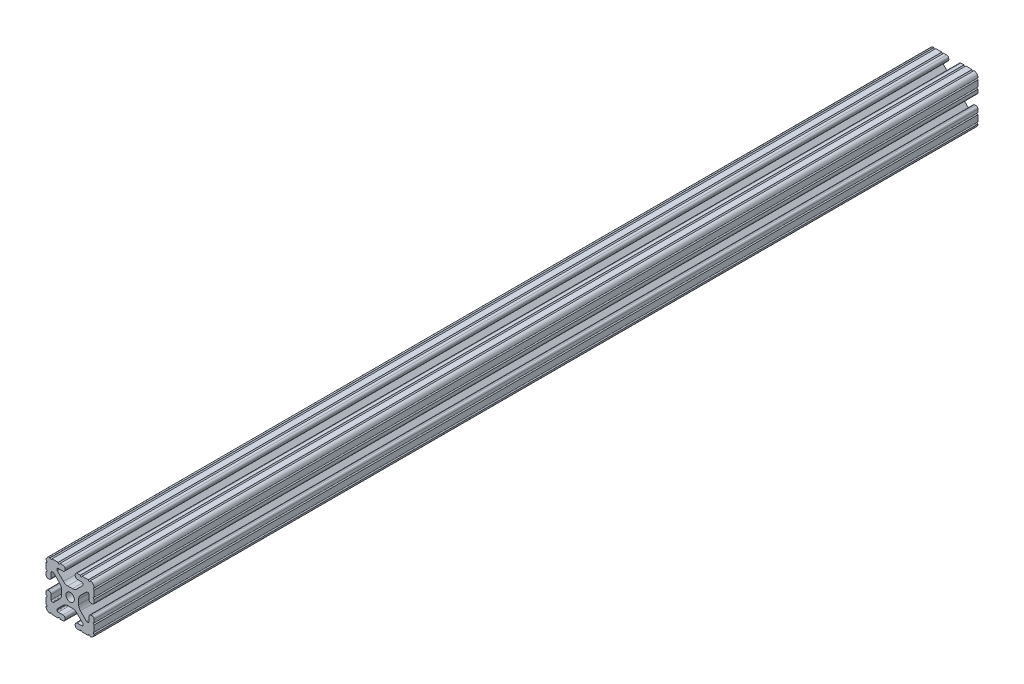
from build123d import *

# Parameters (mm, degrees)
SKETCH1_R           = 3.3274
BOSS_EXTRUDE1_DEPTH = 698.5


with BuildPart() as part:
    # Sketch1 → Boss-Extrude1 (new body)
    with BuildSketch(Plane.XY):
        with BuildLine():
            Line((-14.097, 10.287), (-13.528918, 10.287))
            ThreePointArc((-13.528918, 10.287), (-13.188712428, 10.219328904), (-12.900300071, 10.026617928))
            Line((-12.900300071, 10.026617928), (-8.129198975, 5.255516832))
            ThreePointArc((-8.129198975, 5.255516832), (-7.09957176, 3.71457081), (-6.738014764, 1.896901043))
            Line((-6.738014764, 1.896901043), (-6.738014764, -1.896901043))
            ThreePointArc((-6.738014764, -1.896901043), (-7.09957176, -3.71457081), (-8.129198975, -5.255516832))
            Line((-8.129198975, -5.255516832), (-12.900300071, -10.026617928))
            ThreePointArc((-12.900300071, -10.026617928), (-13.188712428, -10.219328904), (-13.528918, -10.287))
            Line((-13.528918, -10.287), (-14.097, -10.287))
            ThreePointArc((-14.097, -10.287), (-14.725617928, -10.026617928), (-14.986, -9.398))
            Line((-14.986, -9.398), (-14.986, -5.6388))
            ThreePointArc((-14.986, -5.6388), (-15.447248241, -4.525248241), (-16.5608, -4.064))
            Line((-16.5608, -4.064), (-17.4752, -4.064))
            ThreePointArc((-17.4752, -4.064), (-18.588751759, -4.525248241), (-19.05, -5.6388))
            Line((-19.05, -5.6388), (-19.05, -7.9756))
            ThreePointArc((-19.05, -7.9756), (-18.288, -8.7376), (-19.05, -9.4996))
            Line((-19.05, -9.4996), (-19.05, -14.3256))
            ThreePointArc((-19.05, -14.3256), (-18.288, -15.0876), (-19.05, -15.8496))
            Line((-19.05, -15.8496), (-19.05, -15.875))
            ThreePointArc((-19.05, -15.875), (-18.12006403, -18.12006403), (-15.875, -19.05))
            Line((-15.875, -19.05), (-15.8496, -19.05))
            ThreePointArc((-15.8496, -19.05), (-15.0876, -18.288), (-14.3256, -19.05))
            Line((-14.3256, -19.05), (-9.4996, -19.05))
            ThreePointArc((-9.4996, -19.05), (-8.7376, -18.288), (-7.9756, -19.05))
            Line((-7.9756, -19.05), (-5.6388, -19.05))
            ThreePointArc((-5.6388, -19.05), (-4.525248241, -18.588751759), (-4.064, -17.4752))
            Line((-4.064, -17.4752), (-4.064, -16.5608))
            ThreePointArc((-4.064, -16.5608), (-4.525248241, -15.447248241), (-5.6388, -14.986))
            Line((-5.6388, -14.986), (-9.398, -14.986))
            ThreePointArc((-9.398, -14.986), (-10.026617928, -14.725617928), (-10.287, -14.097))
            Line((-10.287, -14.097), (-10.287, -13.528918))
            ThreePointArc((-10.287, -13.528918), (-10.219328904, -13.188712428), (-10.026617928, -12.900300071))
            Line((-10.026617928, -12.900300071), (-5.255516832, -8.129198975))
            ThreePointArc((-5.255516832, -8.129198975), (-3.71457081, -7.09957176), (-1.896901043, -6.738014764))
            Line((-1.896901043, -6.738014764), (1.896901043, -6.738014764))
            ThreePointArc((1.896901043, -6.738014764), (3.71457081, -7.09957176), (5.255516832, -8.129198975))
            Line((5.255516832, -8.129198975), (10.026617928, -12.900300071))
            ThreePointArc((10.026617928, -12.900300071), (10.219328904, -13.188712428), (10.287, -13.528918))
            Line((10.287, -13.528918), (10.287, -14.097))
            ThreePointArc((10.287, -14.097), (10.026617928, -14.725617928), (9.398, -14.986))
            Line((9.398, -14.986), (5.6388, -14.986))
            ThreePointArc((5.6388, -14.986), (4.525248241, -15.447248241), (4.064, -16.5608))
            Line((4.064, -16.5608), (4.064, -17.4752))
            ThreePointArc((4.064, -17.4752), (4.525248241, -18.588751759), (5.6388, -19.05))
            Line((5.6388, -19.05), (7.9756, -19.05))
            ThreePointArc((7.9756, -19.05), (8.7376, -18.288), (9.4996, -19.05))
            Line((9.4996, -19.05), (14.3256, -19.05))
            ThreePointArc((14.3256, -19.05), (15.0876, -18.288), (15.8496, -19.05))
            Line((15.8496, -19.05), (15.875, -19.05))
            ThreePointArc((15.875, -19.05), (18.12006403, -18.12006403), (19.05, -15.875))
            Line((19.05, -15.875), (19.05, -15.8496))
            ThreePointArc((19.05, -15.8496), (18.288, -15.0876), (19.05, -14.3256))
            Line((19.05, -14.3256), (19.05, -9.4996))
            ThreePointArc((19.05, -9.4996), (18.288, -8.7376), (19.05, -7.9756))
            Line((19.05, -7.9756), (19.05, -5.6388))
            ThreePointArc((19.05, -5.6388), (18.588751759, -4.525248241), (17.4752, -4.064))
            Line((17.4752, -4.064), (16.5608, -4.064))
            ThreePointArc((16.5608, -4.064), (15.447248241, -4.525248241), (14.986, -5.6388))
            Line((14.986, -5.6388), (14.986, -9.398))
            ThreePointArc((14.986, -9.398), (14.725617928, -10.026617928), (14.097, -10.287))
            Line((14.097, -10.287), (13.528918, -10.287))
            ThreePointArc((13.528918, -10.287), (13.188712428, -10.219328904), (12.900300071, -10.026617928))
            Line((12.900300071, -10.026617928), (8.129198975, -5.255516832))
            ThreePointArc((8.129198975, -5.255516832), (7.09957176, -3.71457081), (6.738014764, -1.896901043))
            Line((6.738014764, -1.896901043), (6.738014764, 1.896901043))
            ThreePointArc((6.738014764, 1.896901043), (7.09957176, 3.71457081), (8.129198975, 5.255516832))
            Line((8.129198975, 5.255516832), (12.900300071, 10.026617928))
            ThreePointArc((12.900300071, 10.026617928), (13.188712428, 10.219328904), (13.528918, 10.287))
            Line((13.528918, 10.287), (14.097, 10.287))
            ThreePointArc((14.097, 10.287), (14.725617928, 10.026617928), (14.986, 9.398))
            Line((14.986, 9.398), (14.986, 5.6388))
            ThreePointArc((14.986, 5.6388), (15.447248241, 4.525248241), (16.5608, 4.064))
            Line((16.5608, 4.064), (17.4752, 4.064))
            ThreePointArc((17.4752, 4.064), (18.588751759, 4.525248241), (19.05, 5.6388))
            Line((19.05, 5.6388), (19.05, 7.9756))
            ThreePointArc((19.05, 7.9756), (18.288, 8.7376), (19.05, 9.4996))
            Line((19.05, 9.4996), (19.05, 14.3256))
            ThreePointArc((19.05, 14.3256), (18.288, 15.0876), (19.05, 15.8496))
            Line((19.05, 15.8496), (19.05, 15.875))
            ThreePointArc((19.05, 15.875), (18.12006403, 18.12006403), (15.875, 19.05))
            Line((15.875, 19.05), (15.8496, 19.05))
            ThreePointArc((15.8496, 19.05), (15.0876, 18.288), (14.3256, 19.05))
            Line((14.3256, 19.05), (9.4996, 19.05))
            ThreePointArc((9.4996, 19.05), (8.7376, 18.288), (7.9756, 19.05))
            Line((7.9756, 19.05), (5.6388, 19.05))
            ThreePointArc((5.6388, 19.05), (4.525248241, 18.588751759), (4.064, 17.4752))
            Line((4.064, 17.4752), (4.064, 16.5608))
            ThreePointArc((4.064, 16.5608), (4.525248241, 15.447248241), (5.6388, 14.986))
            Line((5.6388, 14.986), (9.398, 14.986))
            ThreePointArc((9.398, 14.986), (10.026617928, 14.725617928), (10.287, 14.097))
            Line((10.287, 14.097), (10.287, 13.528918))
            ThreePointArc((10.287, 13.528918), (10.219328904, 13.188712428), (10.026617928, 12.900300071))
            Line((10.026617928, 12.900300071), (5.255516832, 8.129198975))
            ThreePointArc((5.255516832, 8.129198975), (3.71457081, 7.09957176), (1.896901043, 6.738014764))
            Line((1.896901043, 6.738014764), (-1.896901043, 6.738014764))
            ThreePointArc((-1.896901043, 6.738014764), (-3.71457081, 7.09957176), (-5.255516832, 8.129198975))
            Line((-5.255516832, 8.129198975), (-10.026617928, 12.900300071))
            ThreePointArc((-10.026617928, 12.900300071), (-10.219328904, 13.188712428), (-10.287, 13.528918))
            Line((-10.287, 13.528918), (-10.287, 14.097))
            ThreePointArc((-10.287, 14.097), (-10.026617928, 14.725617928), (-9.398, 14.986))
            Line((-9.398, 14.986), (-5.6388, 14.986))
            ThreePointArc((-5.6388, 14.986), (-4.525248241, 15.447248241), (-4.064, 16.5608))
            Line((-4.064, 16.5608), (-4.064, 17.4752))
            ThreePointArc((-4.064, 17.4752), (-4.525248241, 18.588751759), (-5.6388, 19.05))
            Line((-5.6388, 19.05), (-7.9756, 19.05))
            ThreePointArc((-7.9756, 19.05), (-8.7376, 18.288), (-9.4996, 19.05))
            Line((-9.4996, 19.05), (-14.3256, 19.05))
            ThreePointArc((-14.3256, 19.05), (-15.0876, 18.288), (-15.8496, 19.05))
            Line((-15.8496, 19.05), (-15.875, 19.05))
            ThreePointArc((-15.875, 19.05), (-18.12006403, 18.12006403), (-19.05, 15.875))
            Line((-19.05, 15.875), (-19.05, 15.8496))
            ThreePointArc((-19.05, 15.8496), (-18.288, 15.0876), (-19.05, 14.3256))
            Line((-19.05, 14.3256), (-19.05, 9.4996))
            ThreePointArc((-19.05, 9.4996), (-18.288, 8.7376), (-19.05, 7.9756))
            Line((-19.05, 7.9756), (-19.05, 5.6388))
            ThreePointArc((-19.05, 5.6388), (-18.588751759, 4.525248241), (-17.4752, 4.064))
            Line((-17.4752, 4.064), (-16.5608, 4.064))
            ThreePointArc((-16.5608, 4.064), (-15.447248241, 4.525248241), (-14.986, 5.6388))
            Line((-14.986, 5.6388), (-14.986, 9.398))
            ThreePointArc((-14.986, 9.398), (-14.725617928, 10.026617928), (-14.097, 10.287))
        make_face()
        Circle(SKETCH1_R, mode=Mode.SUBTRACT)
    extrude(amount=BOSS_EXTRUDE1_DEPTH)


solid = part.part
